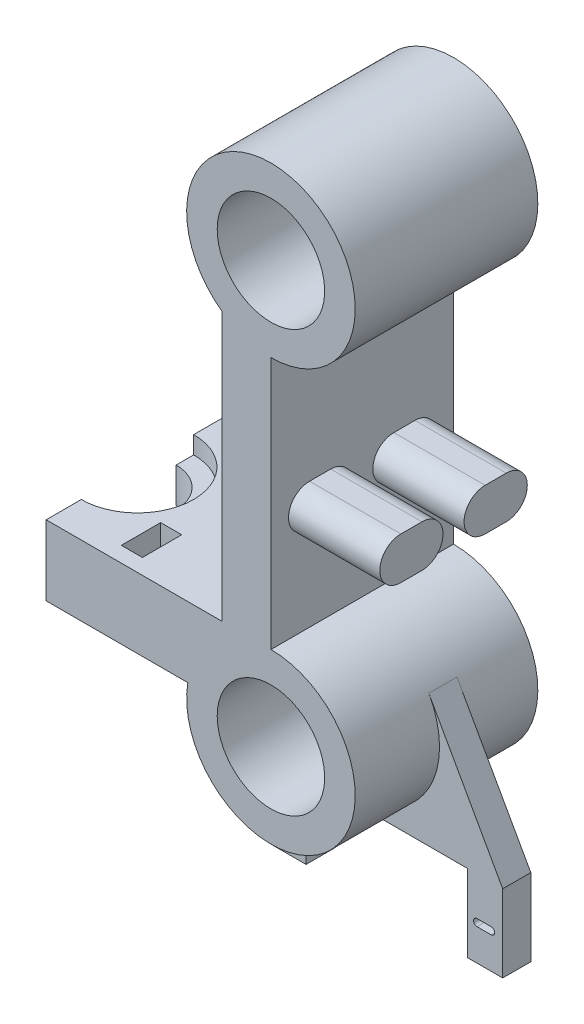
from build123d import *

# Parameters (mm, degrees)
ESBO_O1_R                = 7.65
RESSALTO_EXTRUS_O1_DEPTH = 26
ESBO_O4_R                = 1.75
CORTE_EXTRUS_O1_DEPTH    = 20
ESBO_O5_W                = 3
ESBO_O5_H                = 5.6
CORTE_EXTRUS_O2_DEPTH    = 25
RESSALTO_EXTRUS_O2_DEPTH = 13
RESSALTO_EXTRUS_O3_START = -12
RESSALTO_EXTRUS_O3_DEPTH = 4


with BuildPart() as part:
    # Esboço1 → Ressalto-extrusão1 (new body)
    with BuildSketch(Plane.XY):
        with BuildLine():
            Line((-7, 20.253205655), (-7, -17.999237653))
            Line((-7, -17.999237653), (-32, -17.999237653))
            Line((-32, -17.999237653), (-32, -27.999237653))
            Line((-32, -27.999237653), (-11.832030681, -27.999237653))
            ThreePointArc((-11.832030681, -27.999237653), (7.745671431, -39.165400923), (0, -18))
            Line((0, -18), (0, 18))
            ThreePointArc((0, 18), (3.676851089, 41.422817781), (-7, 20.253205655))
        make_face()
        with Locations(Location((0, 30, 0), (0, 0, 180))):
            Circle(ESBO_O1_R, mode=Mode.SUBTRACT)
        with Locations(Location((0, -30, 0), (0, 0, 180))):
            Circle(ESBO_O1_R, mode=Mode.SUBTRACT)
    extrude(amount=RESSALTO_EXTRUS_O1_DEPTH)

    # Esboço3 → Corte-Revolução1 (revolve, cut)
    with BuildSketch(Plane.ZY.offset(32)):
        Polygon((13, -17.999237653), (21, -17.999237653), (21, -20.499237653), (18.5, -20.499237653), (18.5, -25.499237653), (21, -25.499237653), (21, -27.999237653), (13, -27.999237653), align=None)
    revolve(axis=Axis((-32, -17.999237653, 13), (0, -1, 0)), mode=Mode.SUBTRACT)

    # Esboço4 → Corte-extrusão1 (cut)
    with BuildSketch(Plane.ZY.offset(32)):
        with Locations((5, -22.999237653)):
            Circle(ESBO_O4_R)
        with Locations(Location((21, -22.999237653, 0), (0, 0, 180))):
            Circle(ESBO_O4_R)
    extrude(amount=-CORTE_EXTRUS_O1_DEPTH, mode=Mode.SUBTRACT)

    # Esboço5 → Corte-extrusão2 (cut)
    with BuildSketch(Plane(origin=(0, -17.999237653, 0), x_dir=(1, 0, 0), z_dir=(0, 1, 0))):
        with Locations((-22, -5)):
            Rectangle(ESBO_O5_W, ESBO_O5_H)
        with Locations((-22, -21)):
            Rectangle(ESBO_O5_W, ESBO_O5_H)
    extrude(amount=-CORTE_EXTRUS_O2_DEPTH, mode=Mode.SUBTRACT)

    # Esboço6 → Ressalto-extrusão2 (add)
    with BuildSketch(Plane(origin=(0, 0, 0), x_dir=(0, 0, -1), z_dir=(1, 0, 0))):
        with BuildLine():
            Line((-17.5, -6), (-20.5, -6))
            ThreePointArc((-20.5, -6), (-23.5, -3), (-20.5, 0))
            Line((-20.5, 0), (-17.5, 0))
            ThreePointArc((-17.5, 0), (-14.5, -3), (-17.5, -6))
        make_face()
        with BuildLine():
            Line((-8.5, -6), (-5.5, -6))
            ThreePointArc((-5.5, -6), (-2.5, -3), (-5.5, 0))
            Line((-5.5, 0), (-8.5, 0))
            ThreePointArc((-8.5, 0), (-11.5, -3), (-8.5, -6))
        make_face()
    extrude(amount=RESSALTO_EXTRUS_O2_DEPTH)


with BuildPart() as body_2:
    # Esboço7 → Ressalto-extrusão3 (new body)
    with BuildSketch(Plane.XY.offset(26).offset(RESSALTO_EXTRUS_O3_START)):
        with BuildLine():
            ThreePointArc((10.477995362, -24.15093057), (3.021924524, -41.613267076), (-12, -30))
            Line((-12, -30), (-12, -54))
            Line((-12, -54), (-7, -54))
            Line((-7, -54), (-7, -43))
            Line((-7, -43), (16, -43))
            Line((16, -43), (16, -54))
            Line((16, -54), (21, -54))
            Line((21, -54), (21, -43))
            Line((21, -43), (10.477995362, -24.15093057))
        make_face()
        with BuildLine():
            ThreePointArc((-10.35, -49.5), (-10.85, -49), (-10.35, -48.5))
            Line((-10.35, -48.5), (-8.35, -48.5))
            ThreePointArc((-8.35, -48.5), (-7.85, -49), (-8.35, -49.5))
            Line((-8.35, -49.5), (-10.35, -49.5))
        make_face(mode=Mode.SUBTRACT)
        with BuildLine():
            ThreePointArc((19.35, -48.5), (19.85, -49), (19.35, -49.5))
            Line((19.35, -49.5), (17.35, -49.5))
            ThreePointArc((17.35, -49.5), (16.85, -49), (17.35, -48.5))
            Line((17.35, -48.5), (19.35, -48.5))
        make_face(mode=Mode.SUBTRACT)
    extrude(amount=-RESSALTO_EXTRUS_O3_DEPTH)


solid = Compound([part.part, body_2.part])
